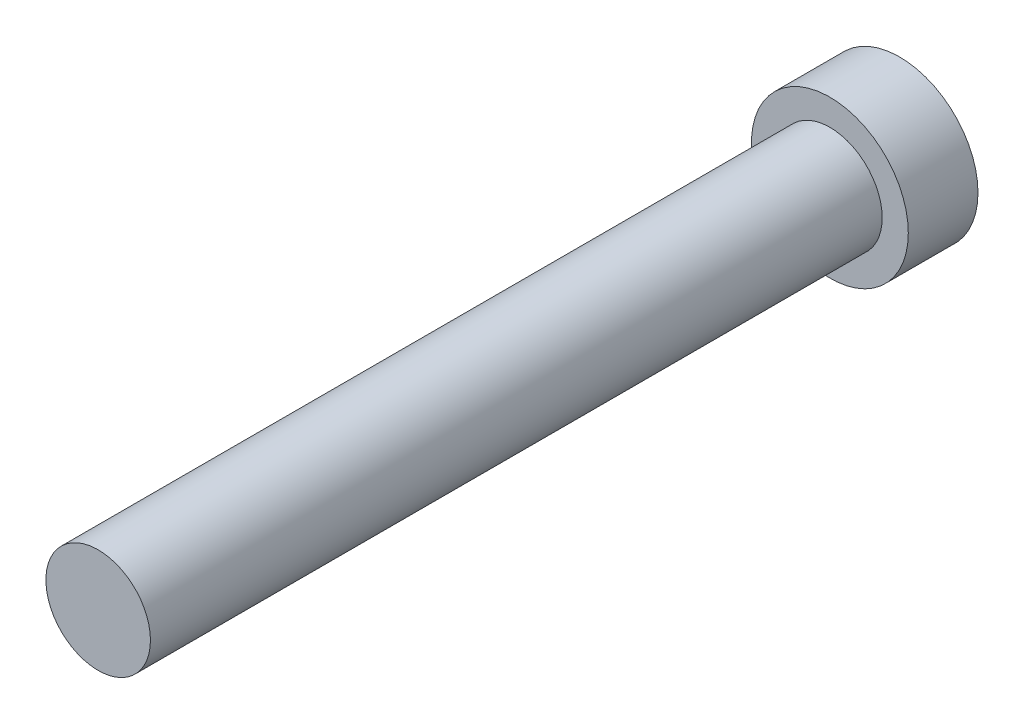
from build123d import *

# Parameters (mm, degrees)
SKETCH1_R           = 22.5
BOSS_EXTRUDE1_DEPTH = 20
SKETCH2_R           = 15
BOSS_EXTRUDE2_DEPTH = 210


with BuildPart() as part:
    # Sketch1 → Boss-Extrude1 (new body)
    with BuildSketch(Plane.XY):
        Circle(SKETCH1_R)
    extrude(amount=BOSS_EXTRUDE1_DEPTH)

    # Sketch2 → Boss-Extrude2 (add)
    with BuildSketch(Plane.XY.offset(20)):
        Circle(SKETCH2_R)
    extrude(amount=BOSS_EXTRUDE2_DEPTH)


solid = part.part
